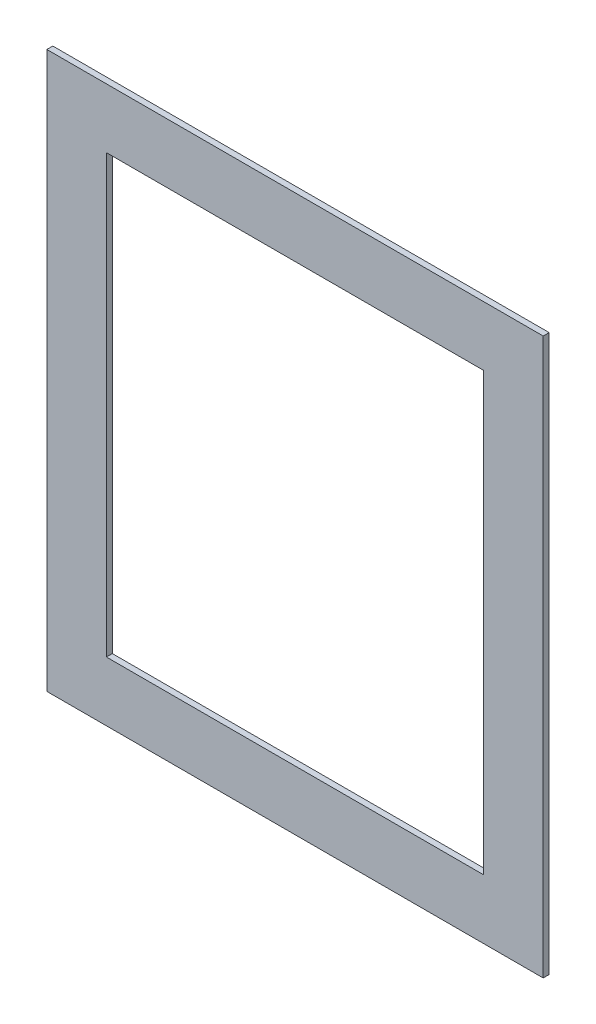
from build123d import *

# Parameters (mm, degrees)
SKETCH_1_W      = 500
SKETCH_1_H      = 560
SKETCH_1_W_2    = 380
SKETCH_1_H_2    = 440
EXTRUDE_1_DEPTH = 6


with BuildPart() as part:
    # Эскиз1 → Бобышка-Вытянуть1 (new body)
    with BuildSketch(Plane.XY):
        with Locations((188.350227198, 260.464227839)):
            Rectangle(SKETCH_1_W, SKETCH_1_H)
        with Locations((188.350227198, 260.464227839)):
            Rectangle(SKETCH_1_W_2, SKETCH_1_H_2, mode=Mode.SUBTRACT)
    extrude(amount=EXTRUDE_1_DEPTH)


solid = part.part
